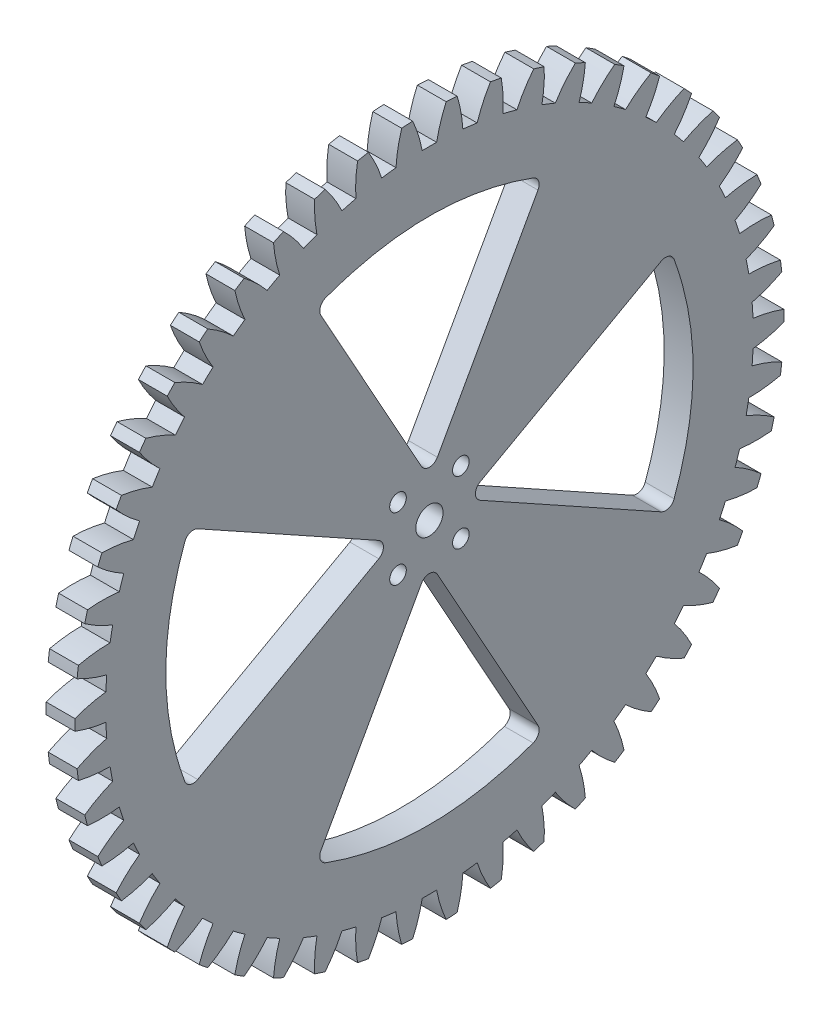
from build123d import *

# Parameters (mm, degrees)
BASPROSKE_W                        = 6.35
BASPROSKE_H                        = 78
TOOTHCUT_DEPTH                     = 111.491277936
TEETHCUTS_COUNT                    = 50
BORSKE_R                           = 3
BORE_DEPTH                         = 50.0002032
ENL_V_MAT_EXTRU_1_REACH            = 112.43
ESQUISSE1_R                        = 1.83
R_P_TITION_CIRCULAIRE1_COUNT       = 4
ENL_V_MAT_EXTRU_2_REACH            = 112.43
CONG_1_R                           = 2
R_P_TITION_CIRCULAIRE2_COUNT       = 4
CONG_1_OF_R_P_TITION_CIRCULAIRE2_R = 2


with BuildPart() as part:
    # BasProSke → Base-Revolve (revolve)
    with BuildSketch(Plane(origin=(0, 0, 0), x_dir=(1, 0, 0), z_dir=(0, 1, 0)), mode=Mode.PRIVATE) as base_revolve_sk:
        with Locations((3.175, 39)):
            Rectangle(BASPROSKE_W, BASPROSKE_H)
    revolve(base_revolve_sk.sketch.rotate(Axis((-10, 0, 0), (1, 0, 0)), 180), axis=Axis((-10, 0, 0), (1, 0, 0)))

    # TooCutSke → ToothCut (cut, through all)
    with BuildSketch(Plane(origin=(0, 0, 0), x_dir=(0, 0, -1), z_dir=(1, 0, 0))):
        with BuildLine():
            ThreePointArc((1.584443832, 71.231380295), (0, 71.249), (-1.584443832, 71.231380295))
            ThreePointArc((-1.584443832, 71.231380295), (-2.443481522, 74.646676615), (-3.696827947, 77.937773309))
            ThreePointArc((-3.696827947, 77.937773309), (0, 78.0254), (3.696827947, 77.937773309))
            ThreePointArc((3.696827947, 77.937773309), (2.443481522, 74.646676615), (1.584443832, 71.231380295))
        make_face()
    toothcut = extrude(amount=TOOTHCUT_DEPTH, mode=Mode.SUBTRACT)

    # TeethCuts: ToothCut ×50 about axis
    teethcuts_axis = Axis((0, 0, 0), (1, 0, 0))
    for i in range(1, TEETHCUTS_COUNT):
        add(toothcut.rotate(teethcuts_axis, i * 360 / TEETHCUTS_COUNT), mode=Mode.SUBTRACT)

    # BorSke → Bore (cut, symmetric)
    with BuildSketch(Plane(origin=(0, 0, 0), x_dir=(0, 0, -1), z_dir=(1, 0, 0))):
        with Locations(Location((0, 0, 0), (0, 0, 180))):
            Circle(BORSKE_R)
    extrude(amount=BORE_DEPTH, both=True, mode=Mode.SUBTRACT)

    # Esquisse1 → Enlèv. mat.-Extru.1 (cut, up to next)
    with BuildSketch(Plane.ZY, mode=Mode.PRIVATE) as enl_v_mat_extru_1_sk1:
        with Locations((6.914797213, 6.914797213)):
            Circle(ESQUISSE1_R)
    enl_v_mat_extru_1_tool1 = extrude(enl_v_mat_extru_1_sk1.sketch, amount=-ENL_V_MAT_EXTRU_1_REACH, mode=Mode.PRIVATE) & part.part
    enl_v_mat_extru_1 = enl_v_mat_extru_1_tool1.solids().sort_by_distance((0, 6.914797, 6.914797))[0]
    add(enl_v_mat_extru_1, mode=Mode.SUBTRACT)

    # Répétition circulaire1: Enlèv. mat.-Extru.1 ×4 about axis
    r_p_tition_circulaire1_axis = Axis((0, 0, 0), (1, 0, 0))
    for i in range(1, R_P_TITION_CIRCULAIRE1_COUNT):
        add(enl_v_mat_extru_1.rotate(r_p_tition_circulaire1_axis, i * 360 / R_P_TITION_CIRCULAIRE1_COUNT), mode=Mode.SUBTRACT)

    # Esquisse2 → Enlèv. mat.-Extru.2 (cut, up to next)
    with BuildSketch(Plane(origin=(6.35, 0, 0), x_dir=(0, 0, -1), z_dir=(1, 0, 0)), mode=Mode.PRIVATE) as enl_v_mat_extru_2_sk1:
        with BuildLine():
            Line((-53, 25), (-8, 0))
            Line((-8, 0), (-53, -25))
            add(Edge.make_bspline(
                [(-53, 25), (-63, 0), (-53, -25)],
                knots=[0, 0, 0, 1, 1, 1], degree=2))
        make_face()
    enl_v_mat_extru_2_tool1 = extrude(enl_v_mat_extru_2_sk1.sketch, amount=-ENL_V_MAT_EXTRU_2_REACH, mode=Mode.PRIVATE) & part.part
    enl_v_mat_extru_2 = enl_v_mat_extru_2_tool1.solids().sort_by_distance((6.35, 0, 40.193548))[0]
    add(enl_v_mat_extru_2, mode=Mode.SUBTRACT)

    # Congé1
    cong_1_edges = [part.edges().sort_by_distance(p)[0] for p in [
        (3.175, -25, 53),
        (3.175, 25, 53),
        (3.175, 0, 8),
    ]]
    fillet(cong_1_edges, radius=CONG_1_R)

    # Répétition circulaire2: Enlèv. mat.-Extru.2 ×4 about axis
    r_p_tition_circulaire2_axis = Axis((6.35, 0, 0), (-1, 0, 0))
    for i in range(1, R_P_TITION_CIRCULAIRE2_COUNT):
        add(enl_v_mat_extru_2.rotate(r_p_tition_circulaire2_axis, i * 360 / R_P_TITION_CIRCULAIRE2_COUNT), mode=Mode.SUBTRACT)

    # Congé1 of Répétition circulaire2
    cong_1_of_r_p_tition_circulaire2_edges = [part.edges().sort_by_distance(p)[0] for p in [
        (3.175, 53, 25),
        (3.175, 53, -25),
        (3.175, 8, 0),
        (3.175, 25, -53),
        (3.175, -25, -53),
        (3.175, 0, -8),
        (3.175, -53, -25),
        (3.175, -53, 25),
        (3.175, -8, 0),
    ]]
    fillet(cong_1_of_r_p_tition_circulaire2_edges, radius=CONG_1_OF_R_P_TITION_CIRCULAIRE2_R)


solid = part.part
